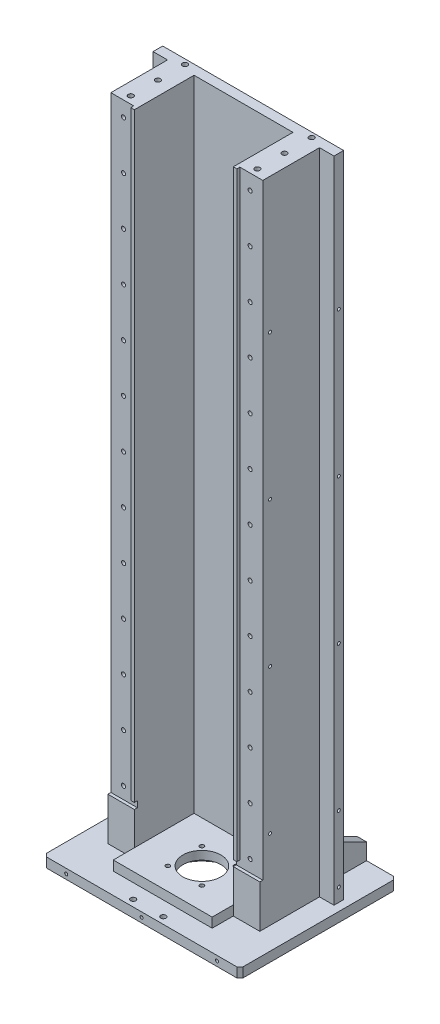
from build123d import *

# Parameters (mm, degrees)
SKETCH1_W                       = 326
SKETCH1_H                       = 260
BOSS_EXTRUDE1_DEPTH             = 16
BOSS_EXTRUDE2_START             = -75
SKETCH3_W                       = 300
SKETCH3_H                       = 1076
BOSS_EXTRUDE2_DEPTH             = 16
BOSS_EXTRUDE3_START             = -37
SKETCH4_W                       = 99
SKETCH4_H                       = 1076
BOSS_EXTRUDE3_DEPTH             = 44
BOSS_EXTRUDE4_START             = -37
SKETCH5_W                       = 99
SKETCH5_H                       = 1076
BOSS_EXTRUDE4_DEPTH             = 44
SKETCH13_W                      = 164
SKETCH13_H                      = 134
BOSS_EXTRUDE7_DEPTH             = 16
BOSS_EXTRUDE5_START             = -50
BOSS_EXTRUDE5_DEPTH             = 16
BOSS_EXTRUDE6_START             = -50
BOSS_EXTRUDE6_DEPTH             = 16
CUT_EXTRUDE1_DEPTH              = 5
CUT_EXTRUDE2_REACH              = 1136.298
SKETCH14_R                      = 31.5
SKETCH15_R                      = 55
CUT_EXTRUDE3_DEPTH              = 18
M10X1_5_TAPPED_HOLE1_AT_2_COUNT = 2
M10X1_5_TAPPED_HOLE1_AT_2_PITCH = 210
LPATTERN1_COUNT                 = 3
LPATTERN1_PITCH                 = 45
M10X1_5_TAPPED_HOLE2_D          = 8.5
M8X1_25_TAPPED_HOLE1_D          = 6.8
M8X1_25_TAPPED_HOLE2_AT_2_COUNT = 2
M8X1_25_TAPPED_HOLE2_AT_2_PITCH = 210
LPATTERN2_COUNT                 = 13
LPATTERN2_PITCH                 = 80
M6X1_0_TAPPED_HOLE1_D           = 5
M6X1_0_TAPPED_HOLE1_DEPTH       = 15
M6X1_0_TAPPED_HOLE1_TIP         = 1.502151548
M6X1_0_TAPPED_HOLE2_AT_2_COUNT  = 2
M6X1_0_TAPPED_HOLE2_AT_2_PITCH  = 240
M6X1_0_TAPPED_HOLE2_AT_3_COUNT  = 2
M6X1_0_TAPPED_HOLE2_AT_3_PITCH  = 480
M6X1_0_TAPPED_HOLE2_AT_4_COUNT  = 2
M6X1_0_TAPPED_HOLE2_AT_4_PITCH  = 720
M6X1_0_TAPPED_HOLE4_AT_2_COUNT  = 2
M6X1_0_TAPPED_HOLE4_AT_2_PITCH  = 240
M6X1_0_TAPPED_HOLE4_AT_3_COUNT  = 2
M6X1_0_TAPPED_HOLE4_AT_3_PITCH  = 480
M6X1_0_TAPPED_HOLE4_AT_4_COUNT  = 2
M6X1_0_TAPPED_HOLE4_AT_4_PITCH  = 720
CHAMFER1_SIZE                   = 5


with BuildPart() as part:
    # Sketch1 → Boss-Extrude1 (new body)
    with BuildSketch(Plane(origin=(0, 0, 0), x_dir=(1, 0, 0), z_dir=(0, 1, 0))):
        with Locations((0, -130)):
            Rectangle(SKETCH1_W, SKETCH1_H)
    extrude(amount=BOSS_EXTRUDE1_DEPTH)


with BuildPart() as body_2:
    # Sketch3 → Boss-Extrude2 (new body)
    with BuildSketch(Plane(origin=(0, 0, 0), x_dir=(-1, 0, 0), z_dir=(0, 0, -1)).offset(BOSS_EXTRUDE2_START)):
        with Locations((0, 554)):
            Rectangle(SKETCH3_W, SKETCH3_H)
    extrude(amount=-BOSS_EXTRUDE2_DEPTH)


with BuildPart() as body_3:
    # Sketch4 → Boss-Extrude3 (new body)
    with BuildSketch(Plane(origin=(163, 0, 0), x_dir=(0, 0, -1), z_dir=(1, 0, 0)).offset(BOSS_EXTRUDE3_START)):
        with Locations((-140.5, 554)):
            Rectangle(SKETCH4_W, SKETCH4_H)
    extrude(amount=-BOSS_EXTRUDE3_DEPTH)


with BuildPart() as body_4:
    # Sketch5 → Boss-Extrude4 (new body)
    with BuildSketch(Plane.ZY.offset(163).offset(BOSS_EXTRUDE4_START)):
        with Locations((140.5, 554)):
            Rectangle(SKETCH5_W, SKETCH5_H)
    extrude(amount=-BOSS_EXTRUDE4_DEPTH)


with BuildPart() as body_5:
    # Sketch13 → Boss-Extrude7 (new body)
    with BuildSketch(Plane(origin=(0, 16, 0), x_dir=(1, 0, 0), z_dir=(0, 1, 0))):
        with Locations((0, -158)):
            Rectangle(SKETCH13_W, SKETCH13_H)
    extrude(amount=BOSS_EXTRUDE7_DEPTH)


with BuildPart() as body_6:
    # Sketch6 → Boss-Extrude5 (new body)
    with BuildSketch(Plane(origin=(163, 0, 0), x_dir=(0, 0, -1), z_dir=(1, 0, 0)).offset(BOSS_EXTRUDE5_START)):
        Polygon((-75, 80), (0, 43), (0, 16), (-75, 16), align=None)
    extrude(amount=-BOSS_EXTRUDE5_DEPTH)


with BuildPart() as body_7:
    # Sketch7 → Boss-Extrude6 (new body)
    with BuildSketch(Plane.ZY.offset(163).offset(BOSS_EXTRUDE6_START)):
        Polygon((0, 43), (0, 16), (75, 16), (75, 80), align=None)
    extrude(amount=-BOSS_EXTRUDE6_DEPTH)


with BuildPart() as body_4_1:
    add(body_4.part)

    # Combine1: union body 2, body 3, part, body 6, body 7, body 5
    add(body_2.part)
    add(body_3.part)
    add(part.part)
    add(body_6.part)
    add(body_7.part)
    add(body_5.part)

    # Sketch8 → Cut-Extrude1 (cut)
    with BuildSketch(Plane.XY.offset(190)):
        Polygon((126, 87), (82, 87), (82, 97), (88, 97), (88, 1092), (126, 1092), align=None)
        Polygon((-126, 1092), (-88, 1092), (-88, 97), (-82, 97), (-82, 87), (-126, 87), align=None)
    extrude(amount=-CUT_EXTRUDE1_DEPTH, mode=Mode.SUBTRACT)

    # Sketch14 → Cut-Extrude2 (cut, up to next)
    with BuildSketch(Plane.XZ, mode=Mode.PRIVATE) as cut_extrude2_sk1:
        with Locations(Location((0, 160, 0), (0, 0, 270))):
            Circle(SKETCH14_R)
    cut_extrude2_tool1 = extrude(cut_extrude2_sk1.sketch, amount=-CUT_EXTRUDE2_REACH, mode=Mode.PRIVATE) & body_4_1.part
    add(cut_extrude2_tool1.solids().sort_by_distance((0, 0, 160))[0], mode=Mode.SUBTRACT)

    # Sketch15 → Cut-Extrude3 (cut)
    with BuildSketch(Plane.XZ):
        with Locations(Location((0, 160, 0), (0, 0, 270))):
            Circle(SKETCH15_R)
    extrude(amount=-CUT_EXTRUDE3_DEPTH, mode=Mode.SUBTRACT)

    # Sketch9 → M10x1.5 Tapped Hole1 (revolve, cut)
    with BuildSketch(Plane(origin=(105, 1092, 83), x_dir=(0, 0, 1), z_dir=(1, 0, 0))):
        Polygon((0, 0), (0, 27.053657631), (4.25, 24.5), (4.25, 0), align=None)
    m10x1_5_tapped_hole1 = revolve(axis=Axis((105, 1098.35, 83), (0, -1, 0)), mode=Mode.SUBTRACT)

    # M10x1.5 Tapped Hole1 at 2: M10x1.5 Tapped Hole1 ×2
    with Locations(*[(-i * M10X1_5_TAPPED_HOLE1_AT_2_PITCH, 0, 0) for i in range(1, M10X1_5_TAPPED_HOLE1_AT_2_COUNT)]):
        add(m10x1_5_tapped_hole1, mode=Mode.SUBTRACT)

    # LPattern1: M10x1.5 Tapped Hole1 ×3
    with Locations(*[(0, 0, i * LPATTERN1_PITCH) for i in range(1, LPATTERN1_COUNT)]):
        add(m10x1_5_tapped_hole1, mode=Mode.SUBTRACT)

    # LPattern1 copy 1 sketch → LPattern1 copy 1 (revolve, cut)
    with BuildSketch(Plane(origin=(-105, 1092, 128), x_dir=(0, 0, 1), z_dir=(1, 0, 0))):
        Polygon((0, 0), (0, 27.053657631), (4.25, 24.5), (4.25, 0), align=None)
    revolve(axis=Axis((-105, 1098.35, 128), (0, -1, 0)), mode=Mode.SUBTRACT)

    # LPattern1 copy 2 sketch → LPattern1 copy 2 (revolve, cut)
    with BuildSketch(Plane(origin=(-105, 1092, 173), x_dir=(0, 0, 1), z_dir=(1, 0, 0))):
        Polygon((0, 0), (0, 27.053657631), (4.25, 24.5), (4.25, 0), align=None)
    revolve(axis=Axis((-105, 1098.35, 173), (0, -1, 0)), mode=Mode.SUBTRACT)

    # M10x1.5 Tapped Hole2 (through all)
    with Locations(Plane.XZ):
        with Locations((-25, 249), (25, 249)):
            Hole(M10X1_5_TAPPED_HOLE2_D / 2)

    # M8x1.25 Tapped Hole1 (through all)
    with Locations(Plane.XZ):
        with Locations((-28.284271247, 188.284271247), (28.284271247, 188.284271247), (28.284271247, 131.715728753), (-28.284271247, 131.715728753)):
            Hole(M8X1_25_TAPPED_HOLE1_D / 2)

    # Sketch18 → M8x1.25 Tapped Hole2 (revolve, cut)
    with BuildSketch(Plane(origin=(105, 107, 185), x_dir=(0, -1, 0), z_dir=(1, 0, 0))):
        Polygon((0, 0), (0, 21.792926105), (3.4, 19.75), (3.4, 0), align=None)
    m8x1_25_tapped_hole2 = revolve(axis=Axis((105, 107, 191.35), (0, 0, -1)), mode=Mode.SUBTRACT)

    # M8x1.25 Tapped Hole2 at 2: M8x1.25 Tapped Hole2 ×2
    with Locations(*[(-i * M8X1_25_TAPPED_HOLE2_AT_2_PITCH, 0, 0) for i in range(1, M8X1_25_TAPPED_HOLE2_AT_2_COUNT)]):
        add(m8x1_25_tapped_hole2, mode=Mode.SUBTRACT)

    # LPattern2: M8x1.25 Tapped Hole2 ×13
    with Locations(*[(0, i * LPATTERN2_PITCH, 0) for i in range(1, LPATTERN2_COUNT)]):
        add(m8x1_25_tapped_hole2, mode=Mode.SUBTRACT)

    # LPattern2 copy 1 sketch → LPattern2 copy 1 (revolve, cut)
    with BuildSketch(Plane(origin=(-105, 187, 185), x_dir=(0, -1, 0), z_dir=(1, 0, 0))):
        Polygon((0, 0), (0, 21.792926105), (3.4, 19.75), (3.4, 0), align=None)
    revolve(axis=Axis((-105, 187, 191.35), (0, 0, -1)), mode=Mode.SUBTRACT)

    # LPattern2 copy 2 sketch → LPattern2 copy 2 (revolve, cut)
    with BuildSketch(Plane(origin=(-105, 267, 185), x_dir=(0, -1, 0), z_dir=(1, 0, 0))):
        Polygon((0, 0), (0, 21.792926105), (3.4, 19.75), (3.4, 0), align=None)
    revolve(axis=Axis((-105, 267, 191.35), (0, 0, -1)), mode=Mode.SUBTRACT)

    # LPattern2 copy 3 sketch → LPattern2 copy 3 (revolve, cut)
    with BuildSketch(Plane(origin=(-105, 347, 185), x_dir=(0, -1, 0), z_dir=(1, 0, 0))):
        Polygon((0, 0), (0, 21.792926105), (3.4, 19.75), (3.4, 0), align=None)
    revolve(axis=Axis((-105, 347, 191.35), (0, 0, -1)), mode=Mode.SUBTRACT)

    # LPattern2 copy 4 sketch → LPattern2 copy 4 (revolve, cut)
    with BuildSketch(Plane(origin=(-105, 427, 185), x_dir=(0, -1, 0), z_dir=(1, 0, 0))):
        Polygon((0, 0), (0, 21.792926105), (3.4, 19.75), (3.4, 0), align=None)
    revolve(axis=Axis((-105, 427, 191.35), (0, 0, -1)), mode=Mode.SUBTRACT)

    # LPattern2 copy 5 sketch → LPattern2 copy 5 (revolve, cut)
    with BuildSketch(Plane(origin=(-105, 507, 185), x_dir=(0, -1, 0), z_dir=(1, 0, 0))):
        Polygon((0, 0), (0, 21.792926105), (3.4, 19.75), (3.4, 0), align=None)
    revolve(axis=Axis((-105, 507, 191.35), (0, 0, -1)), mode=Mode.SUBTRACT)

    # LPattern2 copy 6 sketch → LPattern2 copy 6 (revolve, cut)
    with BuildSketch(Plane(origin=(-105, 587, 185), x_dir=(0, -1, 0), z_dir=(1, 0, 0))):
        Polygon((0, 0), (0, 21.792926105), (3.4, 19.75), (3.4, 0), align=None)
    revolve(axis=Axis((-105, 587, 191.35), (0, 0, -1)), mode=Mode.SUBTRACT)

    # LPattern2 copy 7 sketch → LPattern2 copy 7 (revolve, cut)
    with BuildSketch(Plane(origin=(-105, 667, 185), x_dir=(0, -1, 0), z_dir=(1, 0, 0))):
        Polygon((0, 0), (0, 21.792926105), (3.4, 19.75), (3.4, 0), align=None)
    revolve(axis=Axis((-105, 667, 191.35), (0, 0, -1)), mode=Mode.SUBTRACT)

    # LPattern2 copy 8 sketch → LPattern2 copy 8 (revolve, cut)
    with BuildSketch(Plane(origin=(-105, 747, 185), x_dir=(0, -1, 0), z_dir=(1, 0, 0))):
        Polygon((0, 0), (0, 21.792926105), (3.4, 19.75), (3.4, 0), align=None)
    revolve(axis=Axis((-105, 747, 191.35), (0, 0, -1)), mode=Mode.SUBTRACT)

    # LPattern2 copy 9 sketch → LPattern2 copy 9 (revolve, cut)
    with BuildSketch(Plane(origin=(-105, 827, 185), x_dir=(0, -1, 0), z_dir=(1, 0, 0))):
        Polygon((0, 0), (0, 21.792926105), (3.4, 19.75), (3.4, 0), align=None)
    revolve(axis=Axis((-105, 827, 191.35), (0, 0, -1)), mode=Mode.SUBTRACT)

    # LPattern2 copy 10 sketch → LPattern2 copy 10 (revolve, cut)
    with BuildSketch(Plane(origin=(-105, 907, 185), x_dir=(0, -1, 0), z_dir=(1, 0, 0))):
        Polygon((0, 0), (0, 21.792926105), (3.4, 19.75), (3.4, 0), align=None)
    revolve(axis=Axis((-105, 907, 191.35), (0, 0, -1)), mode=Mode.SUBTRACT)

    # LPattern2 copy 11 sketch → LPattern2 copy 11 (revolve, cut)
    with BuildSketch(Plane(origin=(-105, 987, 185), x_dir=(0, -1, 0), z_dir=(1, 0, 0))):
        Polygon((0, 0), (0, 21.792926105), (3.4, 19.75), (3.4, 0), align=None)
    revolve(axis=Axis((-105, 987, 191.35), (0, 0, -1)), mode=Mode.SUBTRACT)

    # LPattern2 copy 12 sketch → LPattern2 copy 12 (revolve, cut)
    with BuildSketch(Plane(origin=(-105, 1067, 185), x_dir=(0, -1, 0), z_dir=(1, 0, 0))):
        Polygon((0, 0), (0, 21.792926105), (3.4, 19.75), (3.4, 0), align=None)
    revolve(axis=Axis((-105, 1067, 191.35), (0, 0, -1)), mode=Mode.SUBTRACT)

    # M6x1.0 Tapped Hole1
    with Locations(Plane.XY.offset(260)):
        with Locations((125, 8), (-125, 8), (0, 8)):
            Hole(M6X1_0_TAPPED_HOLE1_D / 2, depth=M6X1_0_TAPPED_HOLE1_DEPTH)
            with Locations((0, 0, -(M6X1_0_TAPPED_HOLE1_DEPTH + M6X1_0_TAPPED_HOLE1_TIP / 2))):  # 118° drill point
                Cone(0, M6X1_0_TAPPED_HOLE1_D / 2, M6X1_0_TAPPED_HOLE1_TIP, mode=Mode.SUBTRACT)

    # Sketch22 → M6x1.0 Tapped Hole2 (revolve, cut)
    with BuildSketch(Plane(origin=(126, 148, 173), x_dir=(0, 0, -1), z_dir=(0, 1, 0))):
        Polygon((0, 0), (0, 16.502151548), (2.5, 15), (2.5, 0), align=None)
    m6x1_0_tapped_hole2 = revolve(axis=Axis((132.35, 148, 173), (-1, 0, 0)), mode=Mode.SUBTRACT)

    # M6x1.0 Tapped Hole2 at 2: M6x1.0 Tapped Hole2 ×2
    with Locations(*[(0, i * M6X1_0_TAPPED_HOLE2_AT_2_PITCH, 0) for i in range(1, M6X1_0_TAPPED_HOLE2_AT_2_COUNT)]):
        add(m6x1_0_tapped_hole2, mode=Mode.SUBTRACT)

    # M6x1.0 Tapped Hole2 at 3: M6x1.0 Tapped Hole2 ×2
    with Locations(*[(0, i * M6X1_0_TAPPED_HOLE2_AT_3_PITCH, 0) for i in range(1, M6X1_0_TAPPED_HOLE2_AT_3_COUNT)]):
        add(m6x1_0_tapped_hole2, mode=Mode.SUBTRACT)

    # M6x1.0 Tapped Hole2 at 4: M6x1.0 Tapped Hole2 ×2
    with Locations(*[(0, i * M6X1_0_TAPPED_HOLE2_AT_4_PITCH, 0) for i in range(1, M6X1_0_TAPPED_HOLE2_AT_4_COUNT)]):
        add(m6x1_0_tapped_hole2, mode=Mode.SUBTRACT)

    # Sketch24 → M6x1.0 Tapped Hole3 (revolve, cut)
    with BuildSketch(Plane(origin=(150, 38, 83), x_dir=(0, 0, -1), z_dir=(0, 1, 0))):
        Polygon((0, 0), (0, 16.502151548), (2.5, 15), (2.5, 0), align=None)
    m6x1_0_tapped_hole3 = revolve(axis=Axis((156.35, 38, 83), (-1, 0, 0)), mode=Mode.SUBTRACT)

    # Sketch26 → M6x1.0 Tapped Hole4 (revolve, cut)
    with BuildSketch(Plane(origin=(150, 148, 83), x_dir=(0, 0, -1), z_dir=(0, 1, 0))):
        Polygon((0, 0), (0, 16.502151548), (2.5, 15), (2.5, 0), align=None)
    m6x1_0_tapped_hole4 = revolve(axis=Axis((156.35, 148, 83), (-1, 0, 0)), mode=Mode.SUBTRACT)

    # M6x1.0 Tapped Hole4 at 2: M6x1.0 Tapped Hole4 ×2
    with Locations(*[(0, i * M6X1_0_TAPPED_HOLE4_AT_2_PITCH, 0) for i in range(1, M6X1_0_TAPPED_HOLE4_AT_2_COUNT)]):
        add(m6x1_0_tapped_hole4, mode=Mode.SUBTRACT)

    # M6x1.0 Tapped Hole4 at 3: M6x1.0 Tapped Hole4 ×2
    with Locations(*[(0, i * M6X1_0_TAPPED_HOLE4_AT_3_PITCH, 0) for i in range(1, M6X1_0_TAPPED_HOLE4_AT_3_COUNT)]):
        add(m6x1_0_tapped_hole4, mode=Mode.SUBTRACT)

    # M6x1.0 Tapped Hole4 at 4: M6x1.0 Tapped Hole4 ×2
    with Locations(*[(0, i * M6X1_0_TAPPED_HOLE4_AT_4_PITCH, 0) for i in range(1, M6X1_0_TAPPED_HOLE4_AT_4_COUNT)]):
        add(m6x1_0_tapped_hole4, mode=Mode.SUBTRACT)

    # Mirror1: M6x1.0 Tapped Hole2, M6x1.0 Tapped Hole3, M6x1.0 Tapped Hole4 across plane
    add(m6x1_0_tapped_hole2.mirror(Plane(origin=(0, 0, 0), x_dir=(0, 0, 1), z_dir=(1, 0, 0))), mode=Mode.SUBTRACT)
    add(m6x1_0_tapped_hole3.mirror(Plane(origin=(0, 0, 0), x_dir=(0, 0, 1), z_dir=(1, 0, 0))), mode=Mode.SUBTRACT)
    add(m6x1_0_tapped_hole4.mirror(Plane(origin=(0, 0, 0), x_dir=(0, 0, 1), z_dir=(1, 0, 0))), mode=Mode.SUBTRACT)

    # Mirror1 copy 1 sketch → Mirror1 copy 1 (revolve, cut)
    with BuildSketch(Plane(origin=(-126, 388, 173), x_dir=(0, 0, -1), z_dir=(0, 1, 0))):
        Polygon((0, 0), (0, -16.502151548), (2.5, -15), (2.5, 0), align=None)
    revolve(axis=Axis((-132.35, 388, 173), (-1, 0, 0)), mode=Mode.SUBTRACT)

    # Mirror1 copy 2 sketch → Mirror1 copy 2 (revolve, cut)
    with BuildSketch(Plane(origin=(-126, 628, 173), x_dir=(0, 0, -1), z_dir=(0, 1, 0))):
        Polygon((0, 0), (0, -16.502151548), (2.5, -15), (2.5, 0), align=None)
    revolve(axis=Axis((-132.35, 628, 173), (-1, 0, 0)), mode=Mode.SUBTRACT)

    # Mirror1 copy 3 sketch → Mirror1 copy 3 (revolve, cut)
    with BuildSketch(Plane(origin=(-126, 868, 173), x_dir=(0, 0, -1), z_dir=(0, 1, 0))):
        Polygon((0, 0), (0, -16.502151548), (2.5, -15), (2.5, 0), align=None)
    revolve(axis=Axis((-132.35, 868, 173), (-1, 0, 0)), mode=Mode.SUBTRACT)

    # Mirror1 copy 4 sketch → Mirror1 copy 4 (revolve, cut)
    with BuildSketch(Plane(origin=(-150, 388, 83), x_dir=(0, 0, -1), z_dir=(0, 1, 0))):
        Polygon((0, 0), (0, -16.502151548), (2.5, -15), (2.5, 0), align=None)
    revolve(axis=Axis((-156.35, 388, 83), (-1, 0, 0)), mode=Mode.SUBTRACT)

    # Mirror1 copy 5 sketch → Mirror1 copy 5 (revolve, cut)
    with BuildSketch(Plane(origin=(-150, 628, 83), x_dir=(0, 0, -1), z_dir=(0, 1, 0))):
        Polygon((0, 0), (0, -16.502151548), (2.5, -15), (2.5, 0), align=None)
    revolve(axis=Axis((-156.35, 628, 83), (-1, 0, 0)), mode=Mode.SUBTRACT)

    # Mirror1 copy 6 sketch → Mirror1 copy 6 (revolve, cut)
    with BuildSketch(Plane(origin=(-150, 868, 83), x_dir=(0, 0, -1), z_dir=(0, 1, 0))):
        Polygon((0, 0), (0, -16.502151548), (2.5, -15), (2.5, 0), align=None)
    revolve(axis=Axis((-156.35, 868, 83), (-1, 0, 0)), mode=Mode.SUBTRACT)

    # Chamfer1
    chamfer1_edges = [body_4_1.edges().sort_by_distance(p)[0] for p in [
        (-163, 8, 0),
        (-163, 8, 260),
        (163, 8, 0),
        (163, 8, 260),
    ]]
    chamfer(chamfer1_edges, length=CHAMFER1_SIZE)


solid = body_4_1.part
